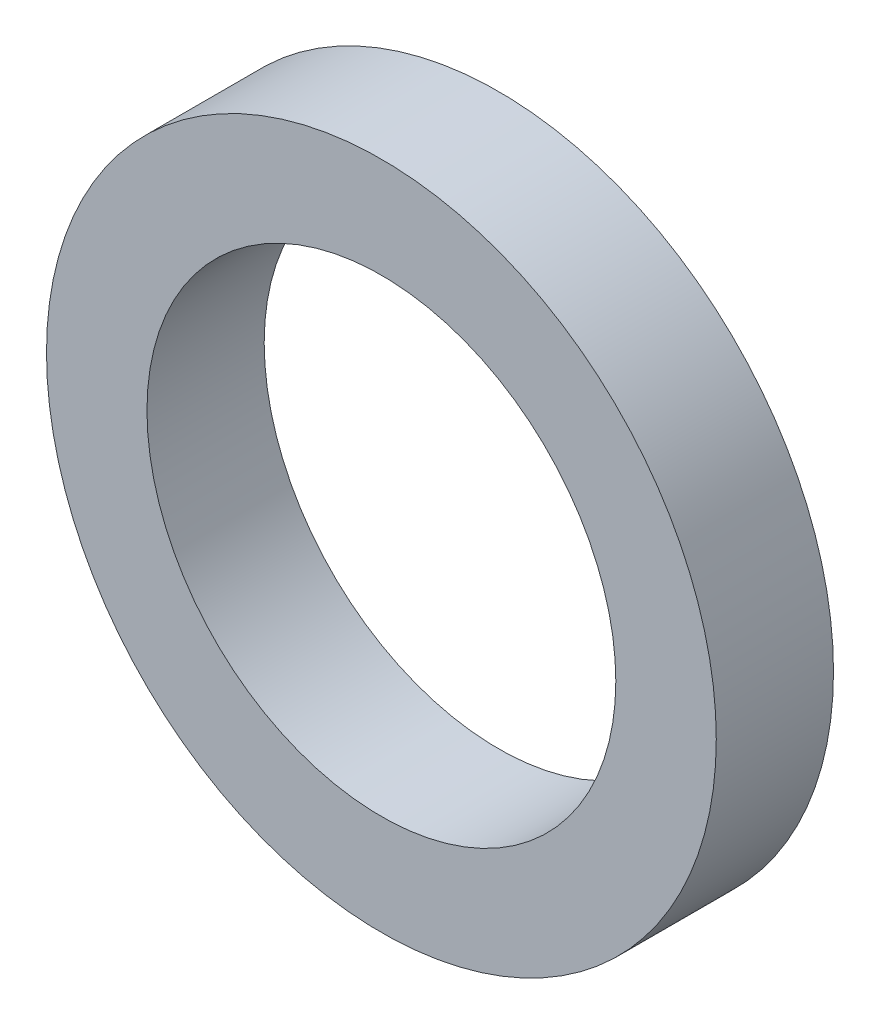
from build123d import *

# Parameters (mm, degrees)
SKETCH1_R           = 20
SKETCH1_R_2         = 14
BOSS_EXTRUDE1_DEPTH = 7


with BuildPart() as part:
    # Sketch1 → Boss-Extrude1 (new body)
    with BuildSketch(Plane.XY):
        Circle(SKETCH1_R)
        Circle(SKETCH1_R_2, mode=Mode.SUBTRACT)
    extrude(amount=BOSS_EXTRUDE1_DEPTH)


solid = part.part
